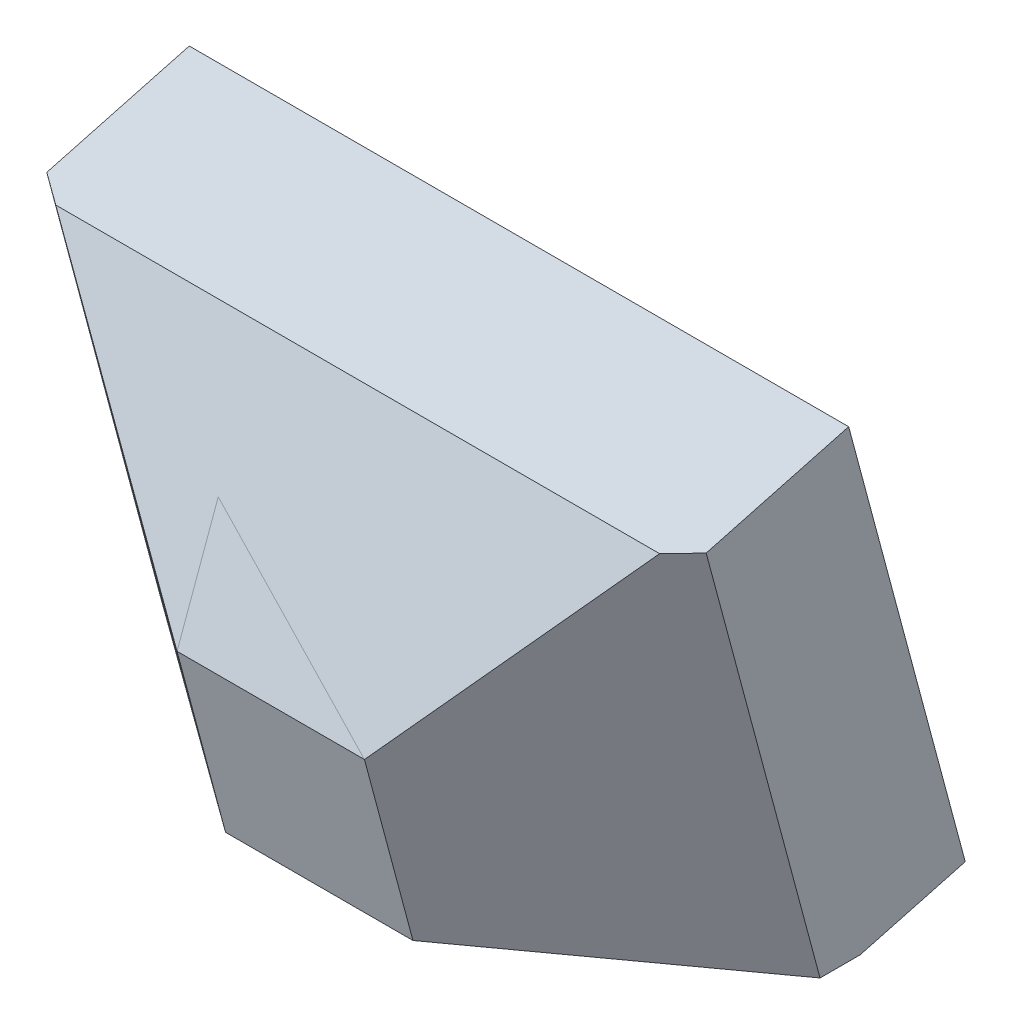
from build123d import *

# Parameters (mm, degrees)
BOSS_EXTRUDE3_DEPTH      = 135
BOSS_EXTRUDE4_DEPTH      = 150
BOSS_EXTRUDE4_DEPTH_BACK = 174.392904
SKETCH5_W                = 537.073181065
SKETCH5_H                = 322.774913197
CUT_EXTRUDE1_DEPTH       = 507.178946947
CUT_EXTRUDE2_DEPTH       = 507.178946947
CUT_EXTRUDE2_DEPTH_BACK  = 507.178946947


with BuildPart() as part:
    # Sketch3 → Boss-Extrude3 (new body)
    with BuildSketch(Plane(origin=(0, 0, 0), x_dir=(0, 0, -1), z_dir=(1, 0, 0))):
        Polygon((0, 0), (-34.940571089, 130.399986549), (27.688853884, 302.472917454), (152.202491734, 302.472917454), (152.202491734, 0), align=None)
    extrude(amount=BOSS_EXTRUDE3_DEPTH)


with BuildPart() as body_2:
    # Sketch4 → Boss-Extrude4 (new, two sides: drawn at the far end of the back side and taken through both)
    with BuildSketch(Plane(origin=(0, 130.399986549, 34.940571089), x_dir=(-1, 0, 0), z_dir=(0, 0.9659258262890673, 0.2588190451025249)).offset(-BOSS_EXTRUDE4_DEPTH_BACK)):
        Polygon((-305, -119.035281496), (-135, 0), (0, 0), (170, -119.035281496), (170, -225.302069257), (-305, -225.302069257), align=None)
    extrude(amount=BOSS_EXTRUDE4_DEPTH + BOSS_EXTRUDE4_DEPTH_BACK)

    # Sketch5 → Cut-Extrude1 (cut, through all)
    with BuildSketch(Plane(origin=(0, 0, 0), x_dir=(1, 0, 0), z_dir=(0, 1, 0))):
        with Locations((80.775113939, 87.718094791)):
            Rectangle(SKETCH5_W, SKETCH5_H)
    extrude(amount=-CUT_EXTRUDE1_DEPTH, mode=Mode.SUBTRACT)

    # Sketch6 → Cut-Extrude2 (cut, two sides: drawn at the far end of the back side and taken through both)
    with BuildSketch(Plane(origin=(0, 0, 0), x_dir=(0, 0, -1), z_dir=(1, 0, 0)).offset(-CUT_EXTRUDE2_DEPTH_BACK)):
        Polygon((-34.940571089, 130.399986549), (35.560367214, 324.099722587), (-80.993250265, 302.270925058), align=None)
    extrude(amount=CUT_EXTRUDE2_DEPTH + CUT_EXTRUDE2_DEPTH_BACK, mode=Mode.SUBTRACT)


solid = Compound([part.part, body_2.part])
